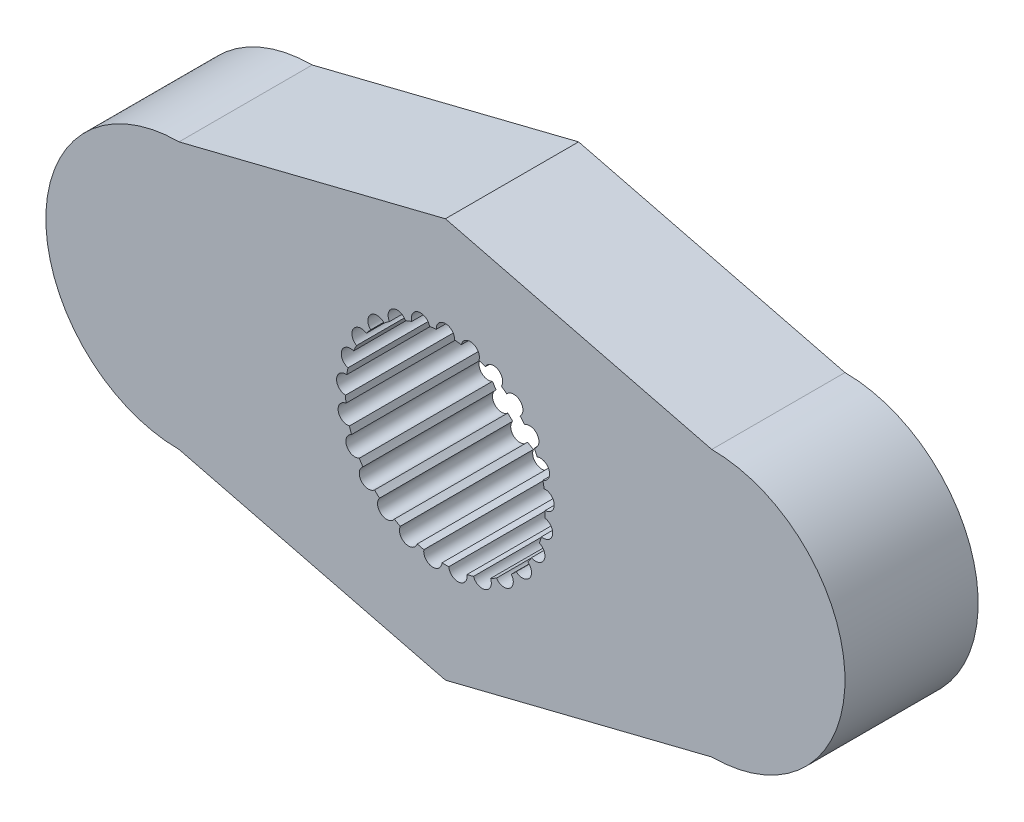
from build123d import *

# Parameters (mm, degrees)
GRUNDK_RPER_DEPTH = 4


with BuildPart() as part:
    # Skizze1 → Grundkörper (new body)
    with BuildSketch(Plane.XY):
        with BuildLine():
            Line((-8, 4), (0, 6))
            Line((0, 6), (8, 4))
            ThreePointArc((8, 4), (12, 0), (8, -4))
            Line((8, -4), (0, -6))
            Line((0, -6), (-8, -4))
            ThreePointArc((-8, -4), (-12, 0), (-8, 4))
        make_face()
        with BuildLine():
            ThreePointArc((1.198457832, 2.75021796), (1.104373658, 2.789329458), (1.009015584, 2.825223452))
            ThreePointArc((1.009015584, 2.825223452), (0.81445938, 3.172109853), (0.476854681, 2.961859148))
            ThreePointArc((0.476854681, 2.961859148), (0.375999701, 2.976344104), (0.274711003, 2.987395833))
            ThreePointArc((0.274711003, 2.987395833), (0, 3.275), (-0.274711003, 2.987395833))
            ThreePointArc((-0.274711003, 2.987395833), (-0.375999701, 2.976344104), (-0.476854681, 2.961859148))
            ThreePointArc((-0.476854681, 2.961859148), (-0.81445938, 3.172109853), (-1.009015584, 2.825223452))
            ThreePointArc((-1.009015584, 2.825223452), (-1.104373658, 2.789329458), (-1.198457832, 2.75021796))
            ThreePointArc((-1.198457832, 2.75021796), (-1.577743283, 2.869904377), (-1.679920005, 2.48553189))
            ThreePointArc((-1.679920005, 2.48553189), (-1.763355757, 2.427050983), (-1.844757469, 2.365770462))
            ThreePointArc((-1.844757469, 2.365770462), (-2.241891772, 2.387372255), (-2.245268875, 1.989665218))
            ThreePointArc((-2.245268875, 1.989665218), (-2.311539728, 1.912271969), (-2.375144211, 1.832672906))
            ThreePointArc((-2.375144211, 1.832672906), (-2.765173956, 1.754832754), (-2.669539243, 1.368780564))
            ThreePointArc((-2.669539243, 1.368780564), (-2.714481157, 1.277337875), (-2.756291906, 1.184421771))
            ThreePointArc((-2.756291906, 1.184421771), (-3.114710091, 1.012030657), (-2.926072642, 0.661890392))
            ThreePointArc((-2.926072642, 0.661890392), (-2.946861752, 0.562143944), (-2.964251643, 0.46174906))
            ThreePointArc((-2.964251643, 0.46174906), (-3.268537536, 0.205638951), (-2.998750137, -0.086588787))
            ThreePointArc((-2.998750137, -0.086588787), (-2.994080185, -0.188371559), (-2.985956549, -0.289937043))
            ThreePointArc((-2.985956549, -0.289937043), (-3.216990746, -0.613673805), (-2.883005131, -0.829627274))
            ThreePointArc((-2.883005131, -0.829627274), (-2.853169549, -0.927050983), (-2.820042823, -1.023405335))
            ThreePointArc((-2.820042823, -1.023405335), (-2.963308597, -1.39442718), (-2.58611031, -1.520537228))
            ThreePointArc((-2.58611031, -1.520537228), (-2.532983777, -1.607480385), (-2.476935434, -1.692569306))
            ThreePointArc((-2.476935434, -1.692569306), (-2.52343087, -2.087563566), (-2.126720668, -2.115906237))
            ThreePointArc((-2.126720668, -2.115906237), (-2.053641318, -2.186905882), (-1.978193083, -2.255382922))
            ThreePointArc((-1.978193083, -2.255382922), (-1.924996701, -2.649530657), (-1.533701344, -2.578325074))
            ThreePointArc((-1.533701344, -2.578325074), (-1.445261022, -2.62892004), (-1.355153586, -2.676482535))
            ThreePointArc((-1.355153586, -2.676482535), (-1.20560791, -3.045017991), (-0.844313924, -2.878738265))
            ThreePointArc((-0.844313924, -2.878738265), (-0.746069661, -2.905749483), (-0.646964804, -2.929408907))
            ThreePointArc((-0.646964804, -2.929408907), (-0.41046634, -3.249175647), (-0.101875155, -2.998269743))
            ThreePointArc((-0.101875155, -2.998269743), (0, -3), (0.101875155, -2.998269743))
            ThreePointArc((0.101875155, -2.998269743), (0.41046634, -3.249175647), (0.646964804, -2.929408907))
            ThreePointArc((0.646964804, -2.929408907), (0.746069661, -2.905749483), (0.844313924, -2.878738265))
            ThreePointArc((0.844313924, -2.878738265), (1.20560791, -3.045017991), (1.355153586, -2.676482535))
            ThreePointArc((1.355153586, -2.676482535), (1.445261022, -2.62892004), (1.533701344, -2.578325074))
            ThreePointArc((1.533701344, -2.578325074), (1.924996701, -2.649530657), (1.978193083, -2.255382922))
            ThreePointArc((1.978193083, -2.255382922), (2.053641318, -2.186905882), (2.126720668, -2.115906237))
            ThreePointArc((2.126720668, -2.115906237), (2.52343087, -2.087563566), (2.476935434, -1.692569306))
            ThreePointArc((2.476935434, -1.692569306), (2.532983777, -1.607480385), (2.58611031, -1.520537228))
            ThreePointArc((2.58611031, -1.520537228), (2.963308597, -1.39442718), (2.820042823, -1.023405335))
            ThreePointArc((2.820042823, -1.023405335), (2.853169549, -0.927050983), (2.883005131, -0.829627274))
            ThreePointArc((2.883005131, -0.829627274), (3.216990746, -0.613673805), (2.985956549, -0.289937043))
            ThreePointArc((2.985956549, -0.289937043), (2.994080185, -0.188371559), (2.998750137, -0.086588787))
            ThreePointArc((2.998750137, -0.086588787), (3.268537536, 0.205638951), (2.964251643, 0.46174906))
            ThreePointArc((2.964251643, 0.46174906), (2.946861752, 0.562143944), (2.926072642, 0.661890392))
            ThreePointArc((2.926072642, 0.661890392), (3.114710091, 1.012030657), (2.756291906, 1.184421771))
            ThreePointArc((2.756291906, 1.184421771), (2.714481157, 1.277337875), (2.669539243, 1.368780564))
            ThreePointArc((2.669539243, 1.368780564), (2.765173956, 1.754832754), (2.375144211, 1.832672906))
            ThreePointArc((2.375144211, 1.832672906), (2.311539728, 1.912271969), (2.245268875, 1.989665218))
            ThreePointArc((2.245268875, 1.989665218), (2.241891772, 2.387372255), (1.844757469, 2.365770462))
            ThreePointArc((1.844757469, 2.365770462), (1.763355757, 2.427050983), (1.679920005, 2.48553189))
            ThreePointArc((1.679920005, 2.48553189), (1.577743283, 2.869904377), (1.198457832, 2.75021796))
        make_face(mode=Mode.SUBTRACT)
    extrude(amount=GRUNDK_RPER_DEPTH)


solid = part.part
